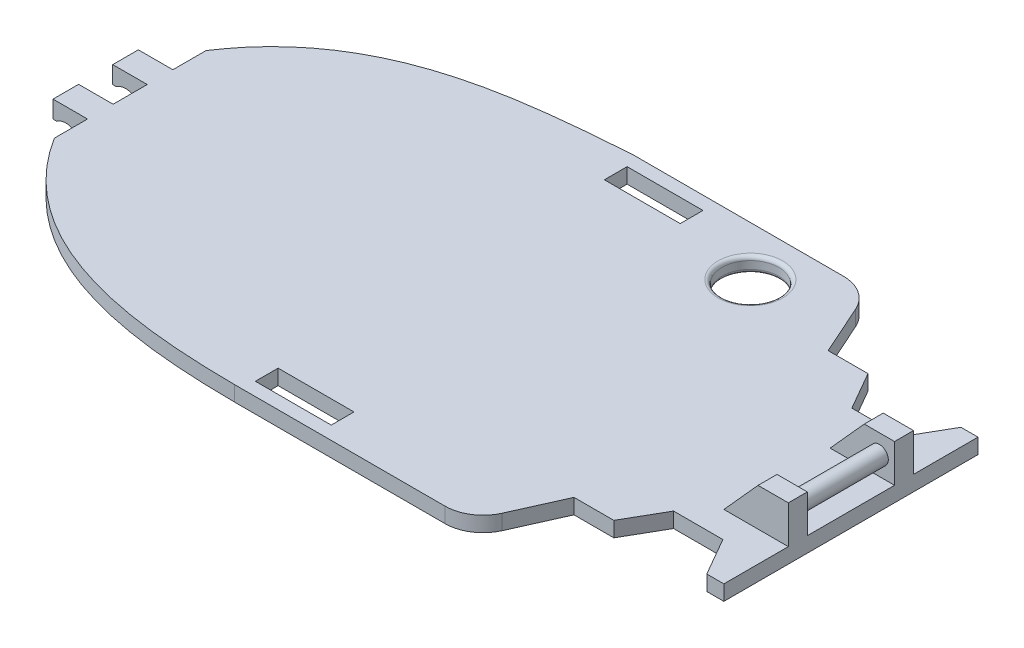
from build123d import *
from build123d.topology import SkipClean

# Parameters (mm, degrees)
BOSS_EXTRUDE1_DEPTH     = 4
BOSS_EXTRUDE2_START     = -45
BOSS_EXTRUDE2_DEPTH     = 3
BOSS_EXTRUDE3_START     = -39
BOSS_EXTRUDE3_DEPTH     = 3
BOSS_EXTRUDE4_REACH     = 213.107
SKETCH6_R               = 2.5
SKETCH7_W               = 20
SKETCH7_H               = 6
CUT_EXTRUDE1_DEPTH      = 10
CUT_EXTRUDE2_DEPTH      = 228.268563733
FILLET1_R               = 10
CUT_EXTRUDE3_DEPTH      = 228.268563733
SKETCH12_W              = 23
SKETCH12_H              = 10
CUT_EXTRUDE6_DEPTH      = 21
BOSS_EXTRUDE5_REACH     = 213.407
SKETCH13_R              = 2.35
CUT_EXTRUDE7_DEPTH      = 209.214432859
CUT_EXTRUDE7_DEPTH_BACK = 209.214432859
SKETCH15_W              = 6
SKETCH15_H              = 4.56544039
SKETCH15_H_2            = 4.038157292
BOSS_EXTRUDE6_DEPTH     = 1
SKETCH8_R               = 7.5
CUT_EXTRUDE8_DEPTH      = 10
FILLET2_R               = 1
BOSS_EXTRUDE7_START     = 0.75
BOSS_EXTRUDE7_DEPTH     = 0.75
BOSS_EXTRUDE8_DEPTH     = 0.75


with BuildPart() as part:
    # Sketch1 → Boss-Extrude1 (new body)
    with BuildSketch(Plane(origin=(0, 0, 0), x_dir=(1, 0, 0), z_dir=(0, 1, 0))):
        with BuildLine():
            Line((-110, 0), (0, 0))
            Line((0, 0), (0, -105))
            Line((0, -105), (-110, -105))
            add(Edge.make_bspline(
                [(-190, -72.5), (-172.262756658, -100.700379519), (-139.265999107, -104.836107107), (-110, -105)],
                knots=[0, 0, 0, 0, 1, 1, 1, 1], degree=3))
            Line((-190, -72.5), (-190, -32.5))
            add(Edge.make_bspline(
                [(-190, -32.5), (-171.707374586, -4.618888995), (-138.989901699, -2.178666842), (-110, 0)],
                knots=[0, 0, 0, 0, 1, 1, 1, 1], degree=3))
        make_face()
    extrude(amount=BOSS_EXTRUDE1_DEPTH)

    # Sketch2 → Boss-Extrude2 (add, symmetric)
    with BuildSketch(Plane.XY.offset(105).offset(BOSS_EXTRUDE2_START)):
        Polygon((-190, 4), (-201, 4), (-201, -11), (-191, -11), (-178, 0), align=None)
    boss_extrude2 = extrude(amount=BOSS_EXTRUDE2_DEPTH, both=True)

    # Mirror1: Boss-Extrude2 across plane
    add(boss_extrude2.mirror(Plane.XY.offset(52.5)))

    # Sketch5 → Boss-Extrude3 (add, symmetric)
    with BuildSketch(Plane.XY.offset(105).offset(BOSS_EXTRUDE3_START)):
        Polygon((-16.979807258, 4), (-7.979807258, 14), (0, 14), (0, 4), align=None)
    boss_extrude3 = extrude(amount=BOSS_EXTRUDE3_DEPTH, both=True)

    # Mirror4: Boss-Extrude3 across plane
    add(boss_extrude3.mirror(Plane.XY.offset(52.5)))

    # Sketch6 → Boss-Extrude4 (add, up to next)
    with BuildSketch(Plane.XY.offset(42), mode=Mode.PRIVATE) as boss_extrude4_sk1:
        with Locations(Location((-4, 10, 0), (0, 0, 180))):
            Circle(SKETCH6_R)
    boss_extrude4_tool1 = extrude(boss_extrude4_sk1.sketch, amount=BOSS_EXTRUDE4_REACH, mode=Mode.PRIVATE) - part.part
    add(boss_extrude4_tool1.solids().sort_by_distance((-4, 10, 42))[0])

    # Sketch7 → Cut-Extrude1 (cut)
    with BuildSketch(Plane(origin=(0, 4, 0), x_dir=(1, 0, 0), z_dir=(0, 1, 0))):
        with Locations((-98, -98.5)):
            Rectangle(SKETCH7_W, SKETCH7_H)
    cut_extrude1 = extrude(amount=-CUT_EXTRUDE1_DEPTH, mode=Mode.SUBTRACT)

    # Mirror5: Cut-Extrude1 across plane
    add(cut_extrude1.mirror(Plane.XY.offset(52.5)), mode=Mode.SUBTRACT)

    # Sketch10 → Cut-Extrude2 (cut, symmetric)
    with BuildSketch(Plane(origin=(0, 4, 0), x_dir=(1, 0, 0), z_dir=(0, 1, 0))):
        Polygon((0, -19), (-39.5, -19), (-48, 0), (0, 0), align=None)
    cut_extrude2 = extrude(amount=CUT_EXTRUDE2_DEPTH, both=True, mode=Mode.SUBTRACT)

    # Mirror6: Cut-Extrude2 across plane
    add(cut_extrude2.mirror(Plane.XY.offset(52.5)), mode=Mode.SUBTRACT)

    # Fillet1
    fillet1_edges = [part.edges().sort_by_distance(p)[0] for p in [
        (-48, 2, 0),
        (-48, 2, 105),
    ]]
    fillet(fillet1_edges, radius=FILLET1_R)

    # Sketch11 → Cut-Extrude3 (cut, symmetric)
    with BuildSketch(Plane(origin=(0, 4, 0), x_dir=(1, 0, 0), z_dir=(0, 1, 0))):
        Polygon((-4.5, -19), (-10.25, -29), (-23.25, -29), (-29, -19), align=None)
    cut_extrude3 = extrude(amount=CUT_EXTRUDE3_DEPTH, both=True, mode=Mode.SUBTRACT)

    # Mirror7: Cut-Extrude3 across plane
    add(cut_extrude3.mirror(Plane.XY.offset(52.5)), mode=Mode.SUBTRACT)

    # Sketch12 → Cut-Extrude6 (cut)
    with BuildSketch(Plane(origin=(0, 0, 0), x_dir=(0, 0, -1), z_dir=(1, 0, 0))):
        with Locations((-52.5, 9)):
            Rectangle(SKETCH12_W, SKETCH12_H)
    extrude(amount=-CUT_EXTRUDE6_DEPTH, mode=Mode.SUBTRACT)

    # Sketch13 → Boss-Extrude5 (add, up to next)
    with BuildSketch(Plane(origin=(0, 0, 64), x_dir=(-1, 0, 0), z_dir=(0, 0, -1)), mode=Mode.PRIVATE) as boss_extrude5_sk1:
        with Locations(Location((3.989903629, 9, 0), (0, 0, 180))):
            Circle(SKETCH13_R)
    boss_extrude5_tool1 = extrude(boss_extrude5_sk1.sketch, amount=BOSS_EXTRUDE5_REACH, mode=Mode.PRIVATE) - part.part
    add(boss_extrude5_tool1.solids().sort_by_distance((-3.989904, 9, 64))[0])

    # Sketch14 → Cut-Extrude7 (cut, two sides: drawn at the far end of the back side and taken through both)
    with BuildSketch(Plane.XY.offset(52.5).offset(-CUT_EXTRUDE7_DEPTH_BACK)):
        with BuildLine():
            Line((-198.09573372, 4), (-198.09573372, -0.56544039))
            ThreePointArc((-198.09573372, -0.56544039), (-191.693337136, -3.763641549), (-198.09573372, -6.961842708))
            Line((-198.09573372, -6.961842708), (-198.09573372, -11))
            Line((-198.09573372, -11), (-202.719197906, -12.115187625))
            Line((-202.719197906, -12.115187625), (-202.588499271, 4.842960165))
            Line((-202.588499271, 4.842960165), (-198.09573372, 4))
        make_face()
    extrude(amount=CUT_EXTRUDE7_DEPTH + CUT_EXTRUDE7_DEPTH_BACK, mode=Mode.SUBTRACT)

    # Sketch15 → Boss-Extrude6 (add)
    with BuildSketch(Plane.ZY.offset(198.09573372)):
        with Locations((60, 1.717279805)):
            Rectangle(SKETCH15_W, SKETCH15_H)
        with Locations((45, 1.717279805)):
            Rectangle(SKETCH15_W, SKETCH15_H)
        with Locations((45, -8.980921354)):
            Rectangle(SKETCH15_W, SKETCH15_H_2)
        with Locations((60, -8.980921354)):
            Rectangle(SKETCH15_W, SKETCH15_H_2)
    extrude(amount=BOSS_EXTRUDE6_DEPTH)

    # Sketch8 → Cut-Extrude8 (cut)
    with BuildSketch(Plane(origin=(0, 4, 0), x_dir=(1, 0, 0), z_dir=(0, 1, 0))):
        with Locations(Location((-66, -13, 0), (0, 0, 270))):
            Circle(SKETCH8_R)
    extrude(amount=-CUT_EXTRUDE8_DEPTH, mode=Mode.SUBTRACT)

    # Fillet2
    fillet2_edges = [part.edges().sort_by_distance(p)[0] for p in [
        (-66, 0, 5.5),
        (-66, 4, 5.5),
    ]]
    fillet(fillet2_edges, radius=FILLET2_R)

    # Sketch16 → Boss-Extrude7 (add)
    with SkipClean():  # the faces are left unmerged after this step: merging them gives an invalid solid
        with BuildSketch(Plane(origin=(0, 0, 42), x_dir=(-1, 0, 0), z_dir=(0, 0, -1)).offset(BOSS_EXTRUDE7_START)):
            with BuildLine():
                Line((198.09573372, -0.56544039), (199.09573372, -0.56544039))
                Line((199.09573372, -0.56544039), (199.09573372, 4))
                Line((199.09573372, 4), (190, 4))
                Line((190, 4), (190, 0))
                Line((190, 0), (178, 0))
                Line((178, 0), (191, -11))
                Line((191, -11), (199.09573372, -11))
                Line((199.09573372, -11), (199.09573372, -6.961842708))
                Line((199.09573372, -6.961842708), (198.09573372, -6.961842708))
                ThreePointArc((198.09573372, -6.961842708), (191.693337136, -3.763641549), (198.09573372, -0.56544039))
            make_face()
        extrude(amount=-BOSS_EXTRUDE7_DEPTH)

    # Sketch17 → Boss-Extrude8 (add)
    with SkipClean():  # the faces are left unmerged after this step: merging them gives an invalid solid
        with BuildSketch(Plane.XY.offset(63)):
            with BuildLine():
                Line((-190, 4), (-199.09573372, 4))
                Line((-199.09573372, 4), (-199.09573372, -0.56544039))
                Line((-199.09573372, -0.56544039), (-198.09573372, -0.56544039))
                ThreePointArc((-198.09573372, -0.56544039), (-191.693337136, -3.763641549), (-198.09573372, -6.961842708))
                Line((-198.09573372, -6.961842708), (-199.09573372, -6.961842708))
                Line((-199.09573372, -6.961842708), (-199.09573372, -11))
                Line((-199.09573372, -11), (-191, -11))
                Line((-191, -11), (-178, 0))
                Line((-178, 0), (-190, 0))
                Line((-190, 0), (-190, 4))
            make_face()
        extrude(amount=BOSS_EXTRUDE8_DEPTH)


solid = part.part
